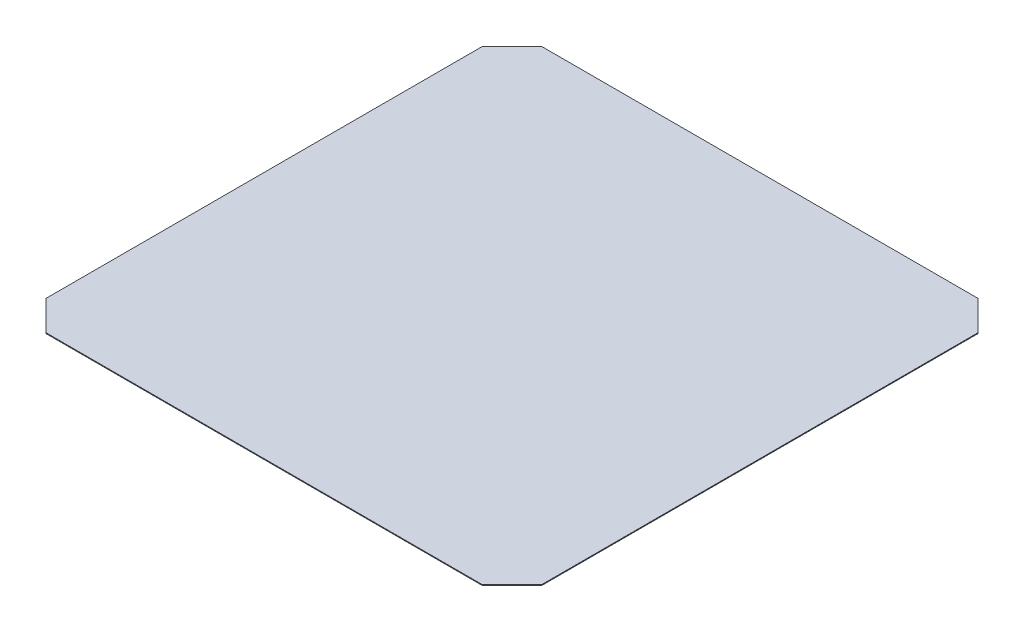
from build123d import *

# Parameters (mm, degrees)
SALIENTE_EXTRUIR1_DEPTH = 0.2


with BuildPart() as part:
    # Croquis2 → Saliente-Extruir1 (new body)
    with BuildSketch(Plane(origin=(0, 0, 0), x_dir=(1, 0, 0), z_dir=(0, 1, 0))):
        Polygon((-62.5, 0), (-62.5, 55), (-55, 62.5), (55, 62.5), (62.5, 55), (62.5, -55), (55, -62.5), (-55, -62.5), (-62.5, -55), align=None)
    extrude(amount=SALIENTE_EXTRUIR1_DEPTH)


solid = part.part
